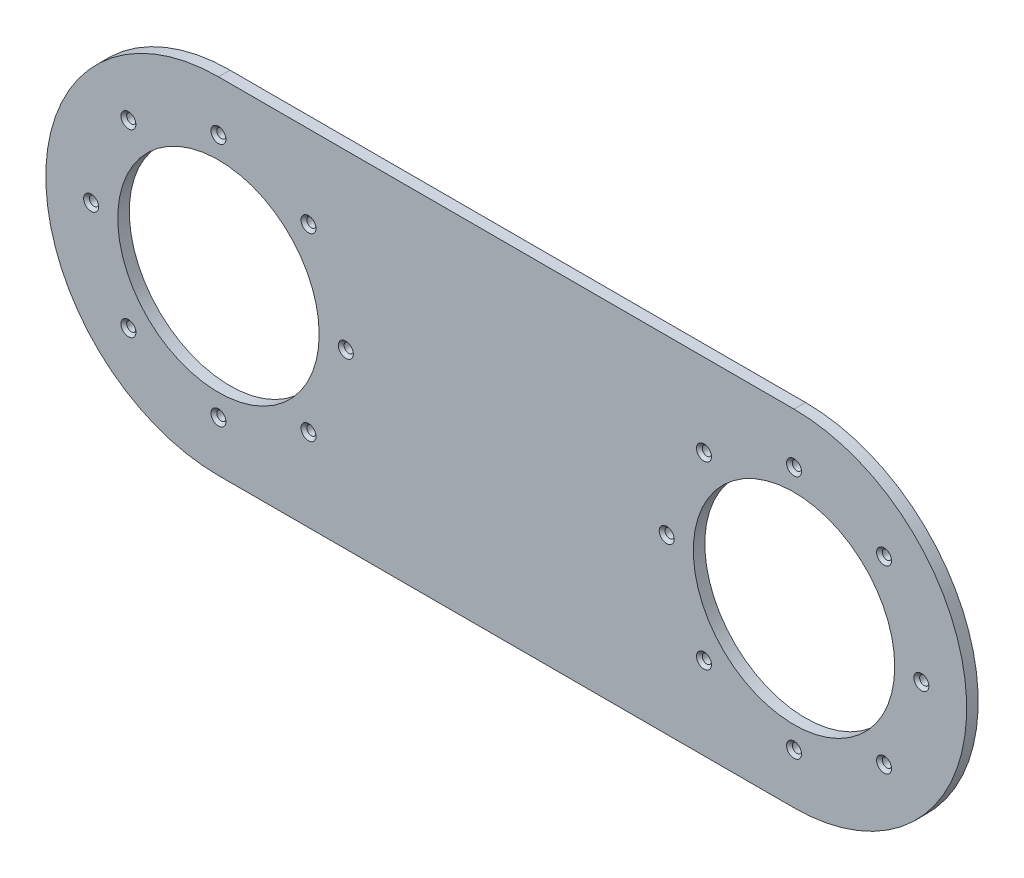
from build123d import *

# Parameters (mm, degrees)
SKETCH_1_R          = 35
EXTRUDE_1_DEPTH     = 4
SKETCH_2_R          = 1.6
CUT_EXTRUDE_1_DEPTH = 5
CHAMFER_1_SIZE      = 1


with BuildPart() as part:
    # 草图1 → 凸台-拉伸1 (new body)
    with BuildSketch(Plane.XY):
        with BuildLine():
            Line((0, 60), (200, 60))
            ThreePointArc((200, 60), (260, 0), (200, -60))
            Line((200, -60), (0, -60))
            ThreePointArc((0, -60), (-60, 0), (0, 60))
        make_face()
        Circle(SKETCH_1_R, mode=Mode.SUBTRACT)
        with Locations((200, 0)):
            Circle(SKETCH_1_R, mode=Mode.SUBTRACT)
    extrude(amount=EXTRUDE_1_DEPTH)

    # 草图2 → 切除-拉伸1 (cut)
    with BuildSketch(Plane.XY.offset(4)):
        with Locations((0, 42.5)):
            Circle(SKETCH_2_R)
        with Locations((0, -42.5)):
            Circle(SKETCH_2_R)
        with Locations((44.25, 0)):
            Circle(SKETCH_2_R)
        with Locations((31.289475068, -31.289475068)):
            Circle(SKETCH_2_R)
        with Locations((-31.289475068, -31.289475068)):
            Circle(SKETCH_2_R)
        with Locations((-44.25, 0)):
            Circle(SKETCH_2_R)
        with Locations((-31.289475068, 31.289475068)):
            Circle(SKETCH_2_R)
        with Locations((31.289475068, 31.289475068)):
            Circle(SKETCH_2_R)
        with Locations((168.710524932, -31.289475068)):
            Circle(SKETCH_2_R)
        with Locations((231.289475068, -31.289475068)):
            Circle(SKETCH_2_R)
        with Locations((200, -42.5)):
            Circle(SKETCH_2_R)
        with Locations((155.75, 0)):
            Circle(SKETCH_2_R)
        with Locations((244.25, 0)):
            Circle(SKETCH_2_R)
        with Locations((168.710524932, 31.289475068)):
            Circle(SKETCH_2_R)
        with Locations((200, 42.5)):
            Circle(SKETCH_2_R)
        with Locations((231.289475068, 31.289475068)):
            Circle(SKETCH_2_R)
    extrude(amount=-CUT_EXTRUDE_1_DEPTH, mode=Mode.SUBTRACT)

    # 倒角1
    chamfer_1_edges = [part.edges().sort_by_distance(p)[0] for p in [
        (-45.85, 0, 4),
        (-32.889475068, -31.289475068, 4),
        (29.689475068, 31.289475068, 4),
        (-1.6, 42.5, 4),
        (167.110524932, 31.289475068, 4),
        (154.15, 0, 4),
        (167.110524932, -31.289475068, 4),
        (198.4, -42.5, 4),
        (229.689475068, -31.289475068, 4),
        (242.65, 0, 4),
        (229.689475068, 31.289475068, 4),
        (198.4, 42.5, 4),
        (-1.6, -42.5, 4),
        (29.689475068, -31.289475068, 4),
        (42.65, 0, 4),
        (-32.889475068, 31.289475068, 4),
    ]]
    chamfer(chamfer_1_edges, length=CHAMFER_1_SIZE)


solid = part.part
